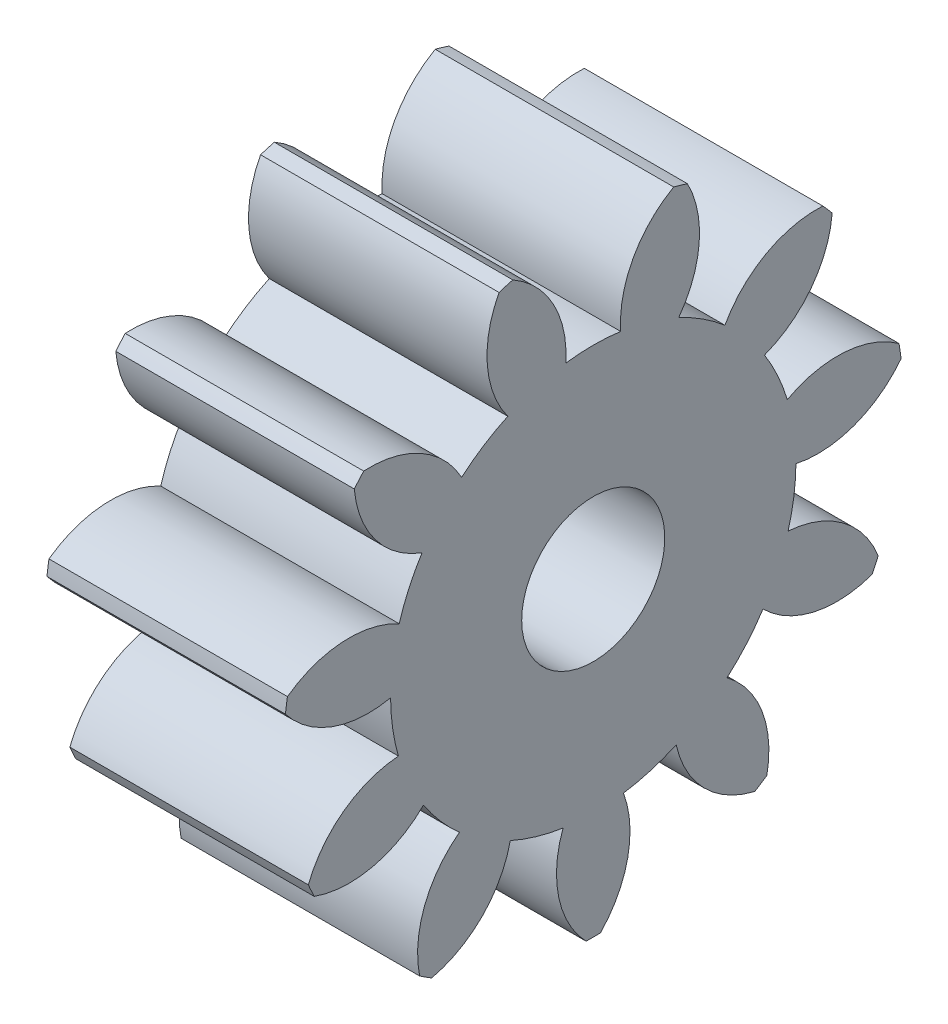
from build123d import *

# Parameters (mm, degrees)
BASPROSKE_W             = 5
BASPROSKE_H             = 6.5
TOOTHCUT_DEPTH          = 11.464224768
TEETHCUTS_COUNT         = 11
TEETHCUTS_ANGLE         = 327.272727273
BORSKE_R                = 1.5
BORE_DEPTH              = 50.0000508
ESQUISSE1_R             = 2.75
ENL_V_MAT_EXTRU_1_DEPTH = 3
ESQUISSE2_R             = 2.75
ESQUISSE2_R_2           = 1.5
BOSS_EXTRU_1_DEPTH      = 3
ENL_V_MAT_EXTRU_2_DEPTH = 2


with BuildPart() as part:
    # BasProSke → Base-Revolve (revolve)
    with BuildSketch(Plane(origin=(0, 0, 0), x_dir=(1, 0, 0), z_dir=(0, 1, 0)), mode=Mode.PRIVATE) as base_revolve_sk:
        with Locations((2.5, 3.25)):
            Rectangle(BASPROSKE_W, BASPROSKE_H)
    revolve(base_revolve_sk.sketch.rotate(Axis((-10, 0, 0), (1, 0, 0)), 180), axis=Axis((-10, 0, 0), (1, 0, 0)))

    # TooCutSke → ToothCut (cut, through all)
    with BuildSketch(Plane(origin=(0, 0, 0), x_dir=(0, 0, -1), z_dir=(1, 0, 0))):
        with BuildLine():
            ThreePointArc((0.576045815, 4.209771041), (0, 4.249), (-0.576045815, 4.209771041))
            ThreePointArc((-0.576045815, 4.209771041), (-0.841371334, 5.420048739), (-1.718652745, 6.295004202))
            ThreePointArc((-1.718652745, 6.295004202), (0, 6.5254), (1.718652745, 6.295004202))
            ThreePointArc((1.718652745, 6.295004202), (0.841371334, 5.420048739), (0.576045815, 4.209771041))
        make_face()
    toothcut = extrude(amount=TOOTHCUT_DEPTH, mode=Mode.SUBTRACT)

    # TeethCuts: ToothCut ×11 about axis
    teethcuts_axis = Axis((-10, 0, 0), (1, 0, 0))
    for i in range(1, TEETHCUTS_COUNT):
        add(toothcut.rotate(teethcuts_axis, i * TEETHCUTS_ANGLE / (TEETHCUTS_COUNT - 1)), mode=Mode.SUBTRACT)

    # BorSke → Bore (cut, symmetric)
    with BuildSketch(Plane(origin=(0, 0, 0), x_dir=(0, 0, -1), z_dir=(1, 0, 0))):
        with Locations(Location((0, 0, 0), (0, 0, 180))):
            Circle(BORSKE_R)
    extrude(amount=BORE_DEPTH, both=True, mode=Mode.SUBTRACT)

    # Esquisse1 → Enlèv. mat.-Extru.1 (cut)
    with BuildSketch(Plane.ZY):
        Circle(ESQUISSE1_R)
    extrude(amount=-ENL_V_MAT_EXTRU_1_DEPTH, mode=Mode.SUBTRACT)

    # Esquisse2 → Boss.-Extru.1 (add)
    with BuildSketch(Plane.ZY.offset(-3)):
        Circle(ESQUISSE2_R)
        Circle(ESQUISSE2_R_2, mode=Mode.SUBTRACT)
    extrude(amount=BOSS_EXTRU_1_DEPTH)

    # Esquisse3 → Enlèv. mat.-Extru.2 (cut)
    with BuildSketch(Plane.ZY):
        Polygon((2.381429268, -2.186807713), (3.084545667, 0.968974387), (0.703116398, 3.1557821), (-2.381429268, 2.186807713), (-3.084545667, -0.968974387), (-0.703116398, -3.1557821), align=None)
    extrude(amount=-ENL_V_MAT_EXTRU_2_DEPTH, mode=Mode.SUBTRACT)


solid = part.part
